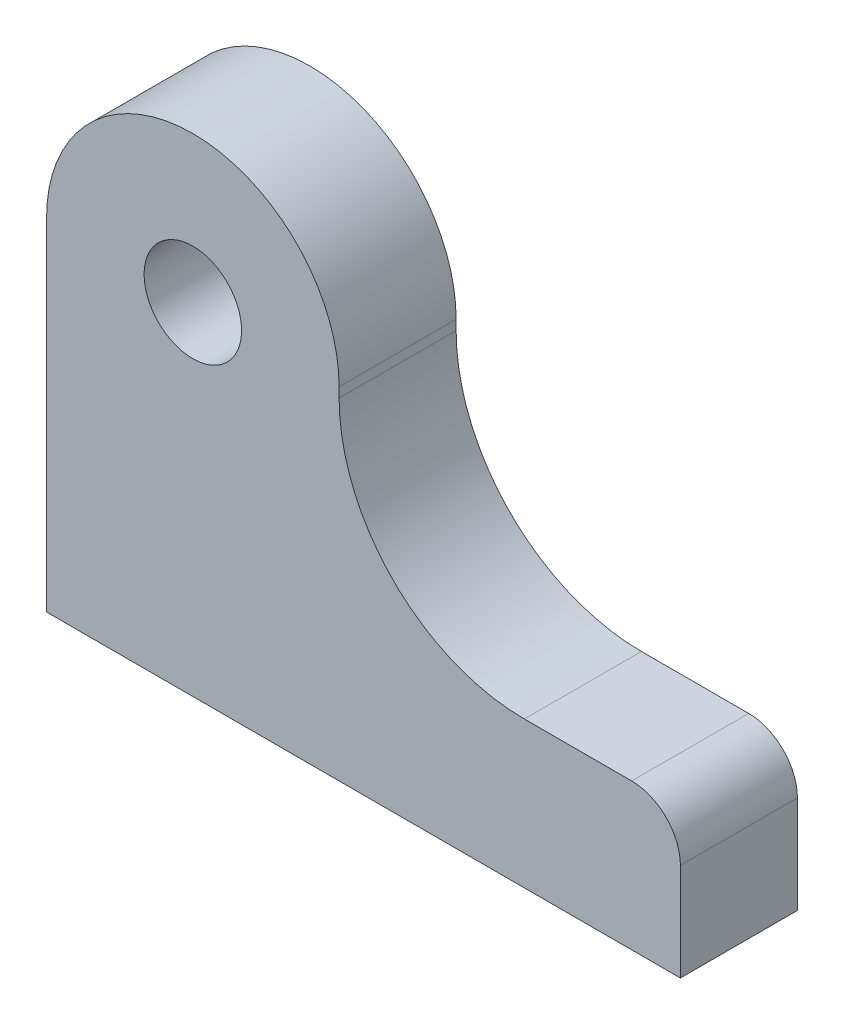
from build123d import *

# Parameters (mm, degrees)
SKETCH_1_W          = 65
SKETCH_1_H          = 50
EXTRUDE_1_DEPTH     = 12
SKETCH_2_R          = 2.5
CUT_EXTRUDE_1_DEPTH = 10
CUT_EXTRUDE_2_DEPTH = 12
SKETCH_4_R          = 5
CUT_EXTRUDE_3_DEPTH = 12
SKETCH_5_R          = 2.5
CUT_EXTRUDE_4_DEPTH = 10


with BuildPart() as part:
    # 草图1 → 凸台-拉伸1 (new body)
    with BuildSketch(Plane.XY):
        Rectangle(SKETCH_1_W, SKETCH_1_H)
    extrude(amount=EXTRUDE_1_DEPTH)

    # 草图2 → 切除-拉伸1 (cut)
    with BuildSketch(Plane(origin=(0, -25, 0), x_dir=(-1, 0, 0), z_dir=(0, -1, 0))):
        with Locations(Location((7.5, -6, 0), (0, 0, 90))):
            Circle(SKETCH_2_R)
        with Locations(Location((-7.5, -6, 0), (0, 0, 90))):
            Circle(SKETCH_2_R)
        with Locations(Location((-22.5, -6, 0), (0, 0, 90))):
            Circle(SKETCH_2_R)
    extrude(amount=-CUT_EXTRUDE_1_DEPTH, mode=Mode.SUBTRACT)

    # 草图3 → 切除-拉伸2 (cut)
    with BuildSketch(Plane(origin=(0, 0, 0), x_dir=(-1, 0, 0), z_dir=(0, 0, -1))):
        with BuildLine():
            ThreePointArc((-32.5, -15), (-31.035533906, -11.464466094), (-27.5, -10))
            Line((-27.5, -10), (-16.5, -10))
            ThreePointArc((-16.5, -10), (-3.064971157, -4.435028843), (2.5, 9))
            Line((2.5, 9), (2.5, 10))
            ThreePointArc((2.5, 10), (6.893398271, 20.606601706), (17.499999967, 25))
            Line((17.499999967, 25), (-32.5, 25))
            Line((-32.5, 25), (-32.5, -15))
        make_face()
        with BuildLine():
            Line((32.5, 25), (17.499999967, 25))
            ThreePointArc((17.499999967, 25), (28.106601706, 20.606601729), (32.5, 10))
            Line((32.5, 10), (32.5, 25))
        make_face()
    extrude(amount=-CUT_EXTRUDE_2_DEPTH, mode=Mode.SUBTRACT)

    # 草图4 → 切除-拉伸3 (cut)
    with BuildSketch(Plane(origin=(0, 0, 0), x_dir=(-1, 0, 0), z_dir=(0, 0, -1))):
        with Locations((17.5, 10)):
            Circle(SKETCH_4_R)
    extrude(amount=-CUT_EXTRUDE_3_DEPTH, mode=Mode.SUBTRACT)

    # 草图5 → 切除-拉伸4 (cut)
    with BuildSketch(Plane.ZY.offset(32.5)):
        with Locations((5, -15)):
            Circle(SKETCH_5_R)
    extrude(amount=-CUT_EXTRUDE_4_DEPTH, mode=Mode.SUBTRACT)


solid = part.part
